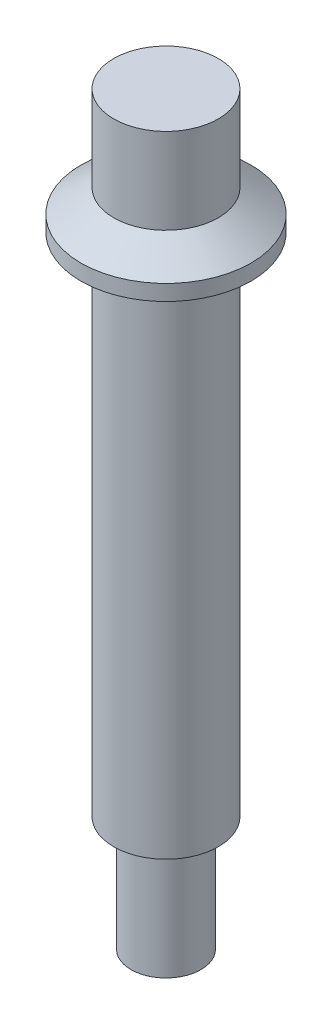
from build123d import *

# Parameters (mm, degrees)
CIRPATTERN1_COUNT = 3


with BuildPart() as part:
    # Sketch1 → Revolve1 (revolve)
    with BuildSketch(Plane(origin=(0, 0, 0), x_dir=(-1, 0, 0), z_dir=(0, 0, -1))):
        Polygon((-65, 262.227948901), (-40, 262.227948901), (-40, -124.772051099), (-26.75, -124.772051099), (-26.75, -212.772051099), (0, -212.772051099), (0, 262.227948901), (0, 357.227948901), (-40, 357.227948901), (-40, 291.733137356), (-65, 274.227948901), align=None)
    revolve(axis=Axis((0, 262.227948901, 0), (0, 1, 0)))

    # Sketch4 → M8x1.0 Tapped Hole1 (revolve, cut)
    with BuildSketch(Plane(origin=(0, -212.772051099, -16), x_dir=(0, 0, -1), z_dir=(1, 0, 0))):
        Polygon((0, 0), (0, 21.103012167), (3.5, 19), (3.5, 0), align=None)
    m8x1_0_tapped_hole1 = revolve(axis=Axis((0, -219.122051099, -16), (0, 1, 0)), mode=Mode.SUBTRACT)

    # CirPattern1: M8x1.0 Tapped Hole1 ×3 about axis
    cirpattern1_axis = Axis((0, -124.772051099, 0), (0, 1, 0))
    for i in range(1, CIRPATTERN1_COUNT):
        add(m8x1_0_tapped_hole1.rotate(cirpattern1_axis, i * 360 / CIRPATTERN1_COUNT), mode=Mode.SUBTRACT)


solid = part.part
